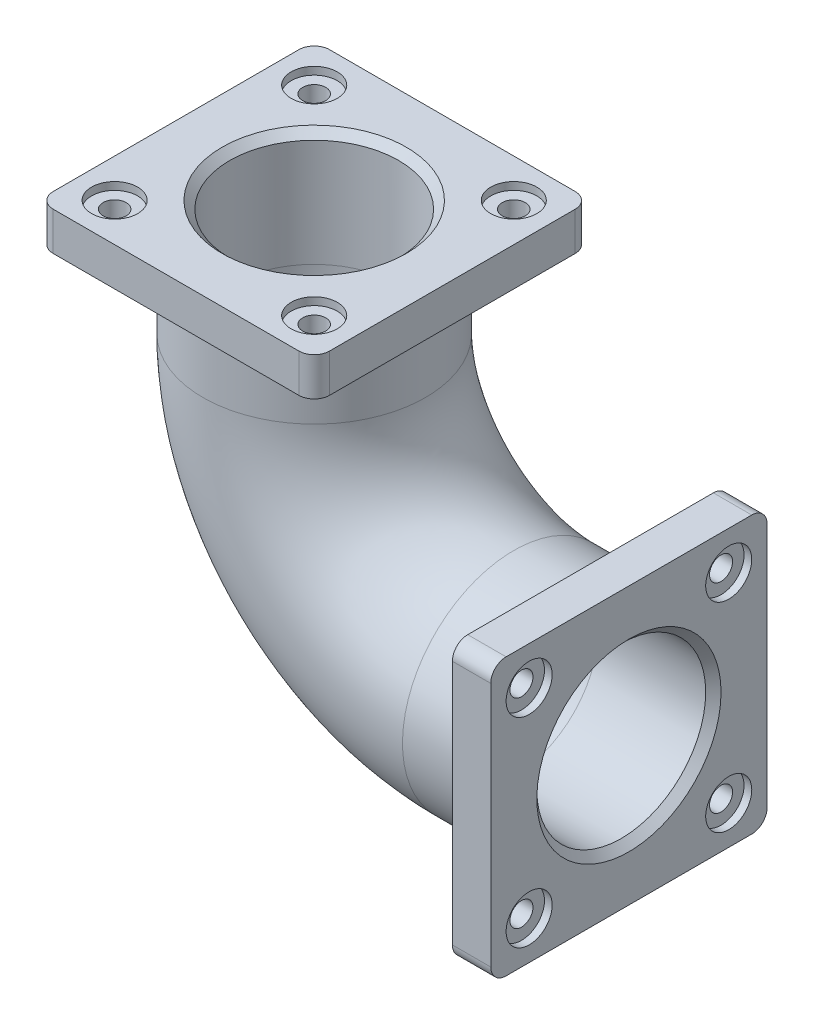
from build123d import *

# Parameters (mm, degrees)
SKETCH2_R                                           = 145
SKETCH2_R_2                                         = 110
BOSS_EXTRUDE2_START                                 = -50
SKETCH8_W                                           = 360
SKETCH8_H                                           = 360
SKETCH8_R                                           = 145
BOSS_EXTRUDE2_DEPTH                                 = 50
FILLET1_R                                           = 20
CBORE_FOR_0_BINDING_HEAD_MACHINE_SCREW3_D           = 29.999999944
CBORE_FOR_0_BINDING_HEAD_MACHINE_SCREW3_DEPTH       = 50
CBORE_FOR_0_BINDING_HEAD_MACHINE_SCREW3_CBORE_D     = 59.999999888
CBORE_FOR_0_BINDING_HEAD_MACHINE_SCREW3_CBORE_DEPTH = 10.000000066
SKETCH21_W                                          = 360
SKETCH21_H                                          = 360
SKETCH21_R                                          = 145
BOSS_EXTRUDE4_DEPTH                                 = 50
CBORE_FOR_0_BINDING_HEAD_MACHINE_SCREW5_D           = 29.999999944
CBORE_FOR_0_BINDING_HEAD_MACHINE_SCREW5_DEPTH       = 50
CBORE_FOR_0_BINDING_HEAD_MACHINE_SCREW5_CBORE_D     = 59.999999888
CBORE_FOR_0_BINDING_HEAD_MACHINE_SCREW5_CBORE_DEPTH = 10.000000066
FILLET2_R                                           = 20
CHAMFER1_SIZE                                       = 10


with BuildPart() as part:
    # Sweep12: sweep along a path in Sketch1
    with BuildLine(Plane.XY) as sweep12_path:
        Line((0, 0), (-150, 0))
        ThreePointArc((-150, 0), (-333.847763109, 76.152236891), (-410, 260))
        Line((-410, 260), (-410, 410))
    # Sketch2 → Sweep12 (sweep)
    with BuildSketch(Plane(origin=(0, 0, 0), x_dir=(0, 0, -1), z_dir=(1, 0, 0))):
        Circle(SKETCH2_R)
        Circle(SKETCH2_R_2, mode=Mode.SUBTRACT)
    sweep(path=sweep12_path.line)

    # Sketch8 → Boss-Extrude2 (add)
    with BuildSketch(Plane(origin=(0, 0, 0), x_dir=(0, 0, -1), z_dir=(1, 0, 0)).offset(BOSS_EXTRUDE2_START)):
        Rectangle(SKETCH8_W, SKETCH8_H)
        with Locations(Location((0, 0, 0), (0, 0, 270))):
            Circle(SKETCH8_R, mode=Mode.SUBTRACT)
    extrude(amount=BOSS_EXTRUDE2_DEPTH)

    # Fillet1
    fillet1_edges = [part.edges().sort_by_distance(p)[0] for p in [
        (-25, 180, -180),
        (-25, -180, -180),
        (-25, -180, 180),
        (-25, 180, 180),
    ]]
    fillet(fillet1_edges, radius=FILLET1_R)

    # CBORE for #0 Binding Head Machine Screw3
    with Locations(Plane(origin=(0, 0, 0), x_dir=(0, 0, -1), z_dir=(1, 0, 0))):
        with Locations((-130, 130), (130, 130), (130, -130), (-130, -130)):
            CounterBoreHole(CBORE_FOR_0_BINDING_HEAD_MACHINE_SCREW3_D / 2, CBORE_FOR_0_BINDING_HEAD_MACHINE_SCREW3_CBORE_D / 2, CBORE_FOR_0_BINDING_HEAD_MACHINE_SCREW3_CBORE_DEPTH, depth=CBORE_FOR_0_BINDING_HEAD_MACHINE_SCREW3_DEPTH)

    # Sketch21 → Boss-Extrude4 (add)
    with BuildSketch(Plane(origin=(0, 410, 0), x_dir=(1, 0, 0), z_dir=(0, 1, 0))):
        with Locations((-410, 0)):
            Rectangle(SKETCH21_W, SKETCH21_H)
        with Locations(Location((-410, 0, 0), (0, 0, 180))):
            Circle(SKETCH21_R, mode=Mode.SUBTRACT)
    extrude(amount=-BOSS_EXTRUDE4_DEPTH)

    # CBORE for #0 Binding Head Machine Screw5
    with Locations(Plane(origin=(0, 410, 0), x_dir=(1, 0, 0), z_dir=(0, 1, 0))):
        with Locations((-540, 130), (-280, 130), (-280, -130), (-540, -130)):
            CounterBoreHole(CBORE_FOR_0_BINDING_HEAD_MACHINE_SCREW5_D / 2, CBORE_FOR_0_BINDING_HEAD_MACHINE_SCREW5_CBORE_D / 2, CBORE_FOR_0_BINDING_HEAD_MACHINE_SCREW5_CBORE_DEPTH, depth=CBORE_FOR_0_BINDING_HEAD_MACHINE_SCREW5_DEPTH)

    # Fillet2
    fillet2_edges = [part.edges().sort_by_distance(p)[0] for p in [
        (-230, 385, -180),
        (-230, 385, 180),
        (-590, 385, 180),
        (-590, 385, -180),
    ]]
    fillet(fillet2_edges, radius=FILLET2_R)

    # Chamfer1
    chamfer1_edges = [part.edges().sort_by_distance(p)[0] for p in [
        (-410, 410, 110),
        (0, 0, 110),
    ]]
    chamfer(chamfer1_edges, length=CHAMFER1_SIZE)


solid = part.part
